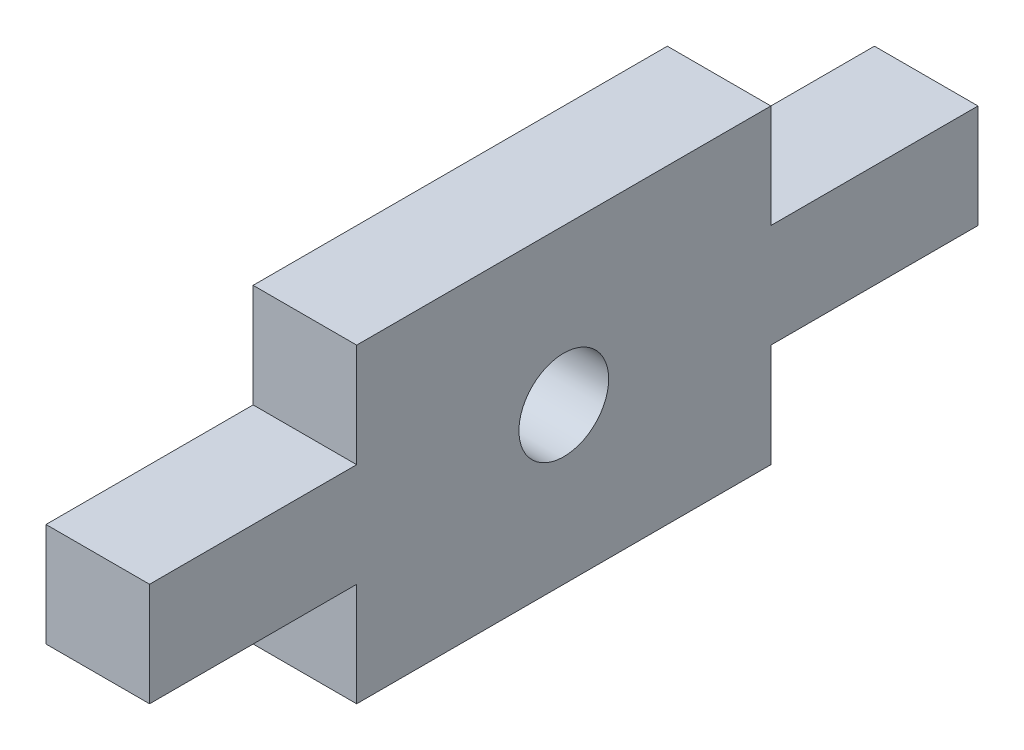
from build123d import *

# Parameters (mm, degrees)
PRINCIPAL_W                  = 12
PRINCIPAL_H                  = 3
PRINCIPAL_W_2                = 24
BASE_DEPTH                   = 3
FURO_DE_DI_METRO_2_6_2_6_1_D = 2.6


with BuildPart() as part:
    # Principal → Base (new body)
    with BuildSketch(Plane(origin=(0, 0, 0), x_dir=(0, 0, -1), z_dir=(1, 0, 0))):
        with Locations((0, 3)):
            Rectangle(PRINCIPAL_W, PRINCIPAL_H)
        Rectangle(PRINCIPAL_W_2, PRINCIPAL_H)
        with Locations((0, -3)):
            Rectangle(PRINCIPAL_W, PRINCIPAL_H)
    extrude(amount=BASE_DEPTH)

    # Furo de diâmetro Ø2.6 (2.6)1 (through all)
    with Locations(Plane(origin=(3, 0, 0), x_dir=(0, 0, -1), z_dir=(1, 0, 0))):
        with Locations((0, 0)):
            Hole(FURO_DE_DI_METRO_2_6_2_6_1_D / 2)


solid = part.part
